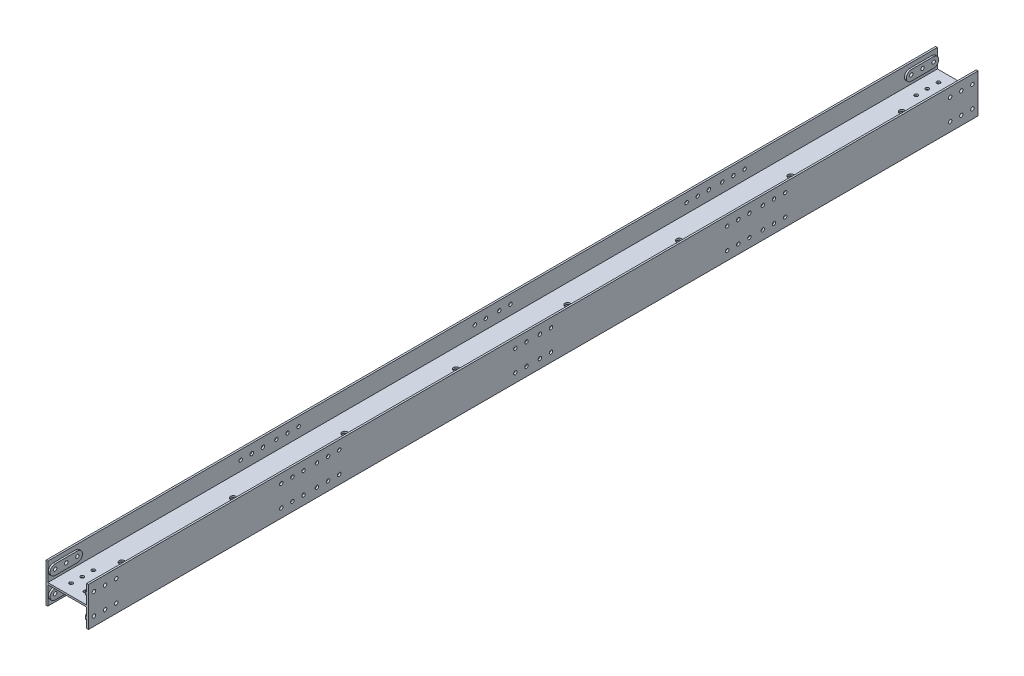
from build123d import *

# Parameters (mm, degrees)
EXTRUDE_1_DEPTH               = 3990
EXTRUDE_2_DEPTH               = 16
PATTERN_LINEAR_1_COUNT        = 2
PATTERN_LINEAR_1_PITCH        = 332
PATTERN_LINEAR_2_COUNT        = 2
PATTERN_LINEAR_2_PITCH        = 190
PATTERN_LINEAR_2_COPY_1_DEPTH = 16
SKETCH_2_R                    = 15.5
CUT_EXTRUDE_3_DEPTH           = 4012.873003972
SKETCH_4_R                    = 15.5
SKETCH_4_R_2                  = 25
CUT_EXTRUDE_4_DEPTH           = 3999.710917283


with BuildPart() as part:
    # 草图1 → 拉伸1 (new body)
    with BuildSketch(Plane.XY):
        Polygon((-174, 175), (-190, 175), (-190, -175), (-174, -175), (-174, -8), (174, -8), (174, -175), (190, -175), (190, 175), (174, 175), (174, 8), (-174, 8), align=None)
    extrude(amount=EXTRUDE_1_DEPTH)

    # 草图3 → 拉伸2 (add)
    with BuildSketch(Plane(origin=(-174, 0, 0), x_dir=(0, 0, -1), z_dir=(1, 0, 0))):
        with BuildLine():
            Line((-3940, 136.80096859), (-3740, 136.80096859))
            ThreePointArc((-3740, 136.80096859), (-3694.69903141, 91.5), (-3740, 46.19903141))
            Line((-3740, 46.19903141), (-3940, 46.19903141))
            ThreePointArc((-3940, 46.19903141), (-3985.30096859, 91.5), (-3940, 136.80096859))
        make_face()
    extrude_2 = extrude(amount=EXTRUDE_2_DEPTH)

    # 阵列(线性)1: 拉伸2 ×2
    with Locations(*[(i * PATTERN_LINEAR_1_PITCH, 0, 0) for i in range(1, PATTERN_LINEAR_1_COUNT)]):
        add(extrude_2)

    # 阵列(线性)2: 拉伸2 ×2
    with Locations(*[(0, -i * PATTERN_LINEAR_2_PITCH, 0) for i in range(1, PATTERN_LINEAR_2_COUNT)]):
        add(extrude_2)

    # 阵列(线性)2 copy 1 sketch → 阵列(线性)2 copy 1 (add)
    with BuildSketch(Plane(origin=(158, -190, 0), x_dir=(0, 0, -1), z_dir=(1, 0, 0))):
        with BuildLine():
            Line((-3940, 136.80096859), (-3740, 136.80096859))
            ThreePointArc((-3740, 136.80096859), (-3694.69903141, 91.5), (-3740, 46.19903141))
            Line((-3740, 46.19903141), (-3940, 46.19903141))
            ThreePointArc((-3940, 46.19903141), (-3985.30096859, 91.5), (-3940, 136.80096859))
        make_face()
    extrude(amount=PATTERN_LINEAR_2_COPY_1_DEPTH)

    # 草图2 → 拉伸3 (cut, through all)
    with BuildSketch(Plane(origin=(190, 0, 0), x_dir=(0, 0, -1), z_dir=(1, 0, 0))):
        with Locations(Location((-3940, 95, 0), (0, 0, 90))):
            Circle(SKETCH_2_R)
        with Locations(Location((-3840, 95, 0), (0, 0, 90))):
            Circle(SKETCH_2_R)
        with Locations(Location((-3740, 95, 0), (0, 0, 90))):
            Circle(SKETCH_2_R)
        with Locations(Location((-3940, -95, 0), (0, 0, 90))):
            Circle(SKETCH_2_R)
        with Locations(Location((-3840, -95, 0), (0, 0, 90))):
            Circle(SKETCH_2_R)
        with Locations(Location((-3740, -95, 0), (0, 0, 90))):
            Circle(SKETCH_2_R)
        with Locations(Location((-2260, 95, 0), (0, 0, 90))):
            Circle(SKETCH_2_R)
        with Locations(Location((-2160, 95, 0), (0, 0, 90))):
            Circle(SKETCH_2_R)
        with Locations(Location((-2060, 95, 0), (0, 0, 90))):
            Circle(SKETCH_2_R)
        with Locations(Location((-2260, -95, 0), (0, 0, 90))):
            Circle(SKETCH_2_R)
        with Locations(Location((-2160, -95, 0), (0, 0, 90))):
            Circle(SKETCH_2_R)
        with Locations(Location((-2060, -95, 0), (0, 0, 90))):
            Circle(SKETCH_2_R)
        with Locations(Location((-1740, 95, 0), (0, 0, 90))):
            Circle(SKETCH_2_R)
        with Locations(Location((-1940, 95, 0), (0, 0, 90))):
            Circle(SKETCH_2_R)
        with Locations(Location((-1840, 95, 0), (0, 0, 90))):
            Circle(SKETCH_2_R)
        with Locations(Location((-1940, -95, 0), (0, 0, 90))):
            Circle(SKETCH_2_R)
        with Locations(Location((-1840, -95, 0), (0, 0, 90))):
            Circle(SKETCH_2_R)
        with Locations(Location((-1740, -95, 0), (0, 0, 90))):
            Circle(SKETCH_2_R)
        with Locations(Location((-60, 95, 0), (0, 0, 90))):
            Circle(SKETCH_2_R)
        with Locations(Location((-60, -95, 0), (0, 0, 90))):
            Circle(SKETCH_2_R)
        with Locations(Location((-160, 95, 0), (0, 0, 90))):
            Circle(SKETCH_2_R)
        with Locations(Location((-160, -95, 0), (0, 0, 90))):
            Circle(SKETCH_2_R)
    extrude(amount=-CUT_EXTRUDE_3_DEPTH, mode=Mode.SUBTRACT)

    # 镜向1: part across plane


with BuildPart() as part_1:
    add(part.part)
    add(part.part.mirror(Plane.XY))

    # 草图4 → 拉伸4 (cut, through all)
    with BuildSketch(Plane(origin=(0, 8, 0), x_dir=(1, 0, 0), z_dir=(0, 1, 0))):
        with Locations(Location((65, 3890, 0), (0, 0, 270))):
            Circle(SKETCH_4_R)
        with Locations(Location((-65, 3890, 0), (0, 0, 270))):
            Circle(SKETCH_4_R)
        with Locations(Location((-65, 3790, 0), (0, 0, 270))):
            Circle(SKETCH_4_R)
        with Locations(Location((65, 3790, 0), (0, 0, 270))):
            Circle(SKETCH_4_R)
        with Locations(Location((-65, 3690, 0), (0, 0, 270))):
            Circle(SKETCH_4_R)
        with Locations(Location((65, 3690, 0), (0, 0, 270))):
            Circle(SKETCH_4_R)
        with Locations(Location((0, 3500, 0), (0, 0, 270))):
            Circle(SKETCH_4_R_2)
        with Locations(Location((0, 2500, 0), (0, 0, 270))):
            Circle(SKETCH_4_R_2)
        with Locations(Location((0, 1500, 0), (0, 0, 270))):
            Circle(SKETCH_4_R_2)
        with Locations(Location((0, 500, 0), (0, 0, 270))):
            Circle(SKETCH_4_R_2)
        with Locations(Location((0, -500, 0), (0, 0, 180))):
            Circle(SKETCH_4_R_2)
        with Locations(Location((0, -1500, 0), (0, 0, 180))):
            Circle(SKETCH_4_R_2)
        with Locations(Location((0, -2500, 0), (0, 0, 180))):
            Circle(SKETCH_4_R_2)
        with Locations(Location((0, -3500, 0), (0, 0, 180))):
            Circle(SKETCH_4_R_2)
        with Locations(Location((-65, -3790, 0), (0, 0, 180))):
            Circle(SKETCH_4_R)
        with Locations(Location((-65, -3690, 0), (0, 0, 180))):
            Circle(SKETCH_4_R)
        with Locations(Location((65, -3690, 0), (0, 0, 180))):
            Circle(SKETCH_4_R)
        with Locations(Location((65, -3790, 0), (0, 0, 180))):
            Circle(SKETCH_4_R)
        with Locations(Location((65, -3890, 0), (0, 0, 180))):
            Circle(SKETCH_4_R)
        with Locations(Location((-65, -3890, 0), (0, 0, 180))):
            Circle(SKETCH_4_R)
    extrude(amount=-CUT_EXTRUDE_4_DEPTH, mode=Mode.SUBTRACT)


solid = part_1.part
